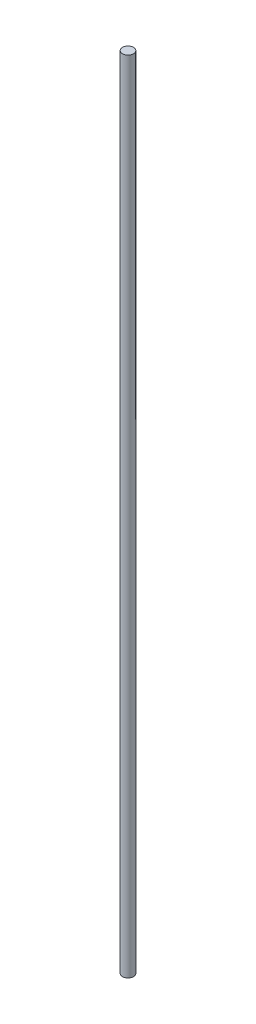
from build123d import *

# Parameters (mm, degrees)
ESQUISSE1_R        = 5
BOSS_EXTRU_1_DEPTH = 720


with BuildPart() as part:
    # Esquisse1 → Boss.-Extru.1 (new body)
    with BuildSketch(Plane(origin=(0, 0, 0), x_dir=(1, 0, 0), z_dir=(0, 1, 0))):
        with Locations(Location((0, 0, 0), (0, 0, 90))):
            Circle(ESQUISSE1_R)
    extrude(amount=BOSS_EXTRU_1_DEPTH)


solid = part.part
